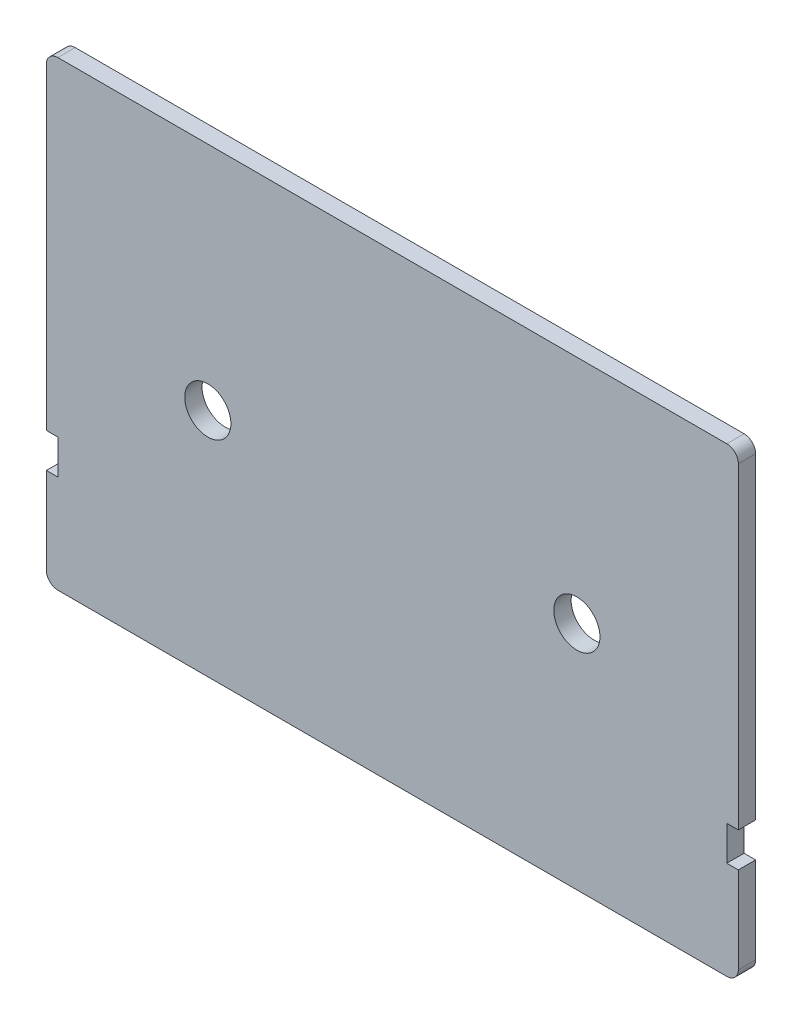
from build123d import *

# Parameters (mm, degrees)
SKETCH_1_W          = 60
SKETCH_1_H          = 40
EXTRUDE_1_DEPTH     = 1.5
SKETCH_3_R          = 2
CUT_EXTRUDE_1_DEPTH = 10
SKETCH_4_W          = 1
SKETCH_4_H          = 3
CUT_EXTRUDE_2_DEPTH = 10
FILLET_1_R          = 1


with BuildPart() as part:
    # 草图1 → 凸台-拉伸1 (new body)
    with BuildSketch(Plane.XY):
        Rectangle(SKETCH_1_W, SKETCH_1_H)
    extrude(amount=EXTRUDE_1_DEPTH)

    # 草图3 → 切除-拉伸1 (cut)
    with BuildSketch(Plane.XY.offset(1.5)):
        with Locations((-16, 0)):
            Circle(SKETCH_3_R)
        with Locations((16, 0)):
            Circle(SKETCH_3_R)
    extrude(amount=-CUT_EXTRUDE_1_DEPTH, mode=Mode.SUBTRACT)

    # 草图4 → 切除-拉伸2 (cut)
    with BuildSketch(Plane.XY.offset(1.5)):
        with Locations((-29.5, -10)):
            Rectangle(SKETCH_4_W, SKETCH_4_H)
        with Locations((29.5, -10)):
            Rectangle(SKETCH_4_W, SKETCH_4_H)
    extrude(amount=-CUT_EXTRUDE_2_DEPTH, mode=Mode.SUBTRACT)

    # 圆角1
    fillet_1_edges = [part.edges().sort_by_distance(p)[0] for p in [
        (-30, 20, 0.75),
        (30, 20, 0.75),
        (30, -20, 0.75),
        (-30, -20, 0.75),
    ]]
    fillet(fillet_1_edges, radius=FILLET_1_R)


solid = part.part
